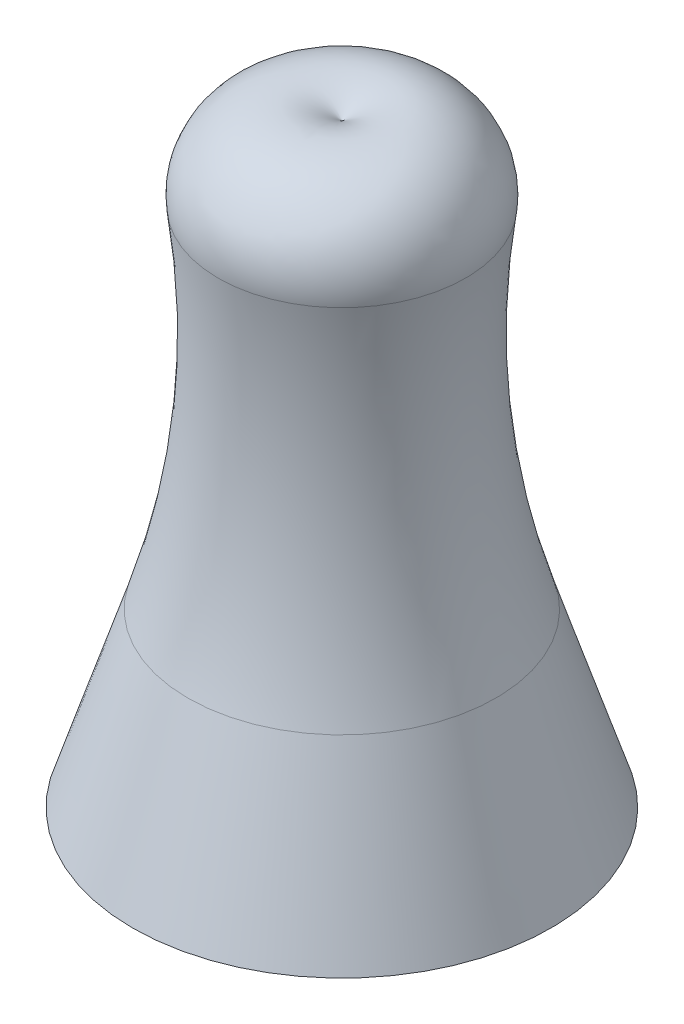
from build123d import *

# Parameters (mm, degrees)
SKETCH4_R          = 2
CUT_EXTRUDE3_DEPTH = 10


with BuildPart() as part:
    # Sketch1 → Revolve2 (revolve)
    with BuildSketch(Plane.XY, mode=Mode.PRIVATE) as revolve2_sk:
        with BuildLine():
            Line((-14.319865134, 0), (-14.319865134, -22.730738562))
            Line((-14.319865134, -22.730738562), (-6.319865134, -22.730738562))
            Line((-6.319865134, -22.730738562), (-8.431586918, -16.171866575))
            ThreePointArc((-8.431586918, -16.171866575), (-9.762730431, -9.572895053), (-9.588924395, -2.843247242))
            ThreePointArc((-9.588924395, -2.843247242), (-11.014939587, 0.14155622), (-14.319865134, 0))
        make_face()
    revolve(revolve2_sk.sketch.rotate(Axis((-14.319865134, 0, 0), (0, -1, 0)), 90), axis=Axis((-14.319865134, 0, 0), (0, -1, 0)))

    # Sketch4 → Cut-Extrude3 (cut)
    with BuildSketch(Plane.XZ.offset(22.730738562)):
        with Locations((-14.319865134, 0)):
            Circle(SKETCH4_R)
    extrude(amount=-CUT_EXTRUDE3_DEPTH, mode=Mode.SUBTRACT)


solid = part.part
